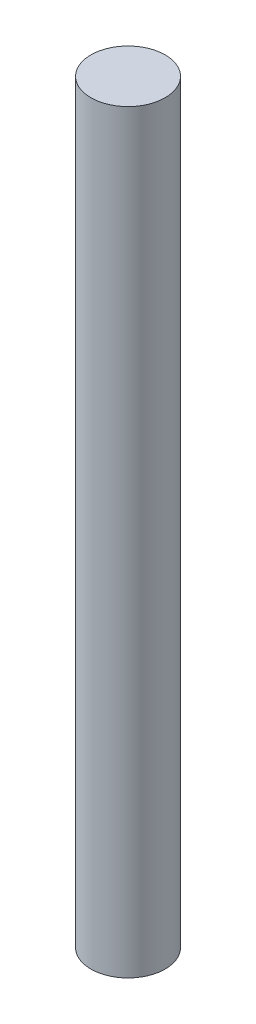
from build123d import *

# Parameters (mm, degrees)
SKETCH1_R           = 7.5
BOSS_EXTRUDE1_DEPTH = 152.4


with BuildPart() as part:
    # Sketch1 → Boss-Extrude1 (new body)
    with BuildSketch(Plane(origin=(0, 0, 0), x_dir=(1, 0, 0), z_dir=(0, 1, 0))):
        with Locations(Location((0, 0, 0), (0, 0, 90))):
            Circle(SKETCH1_R)
    extrude(amount=BOSS_EXTRUDE1_DEPTH)


solid = part.part
